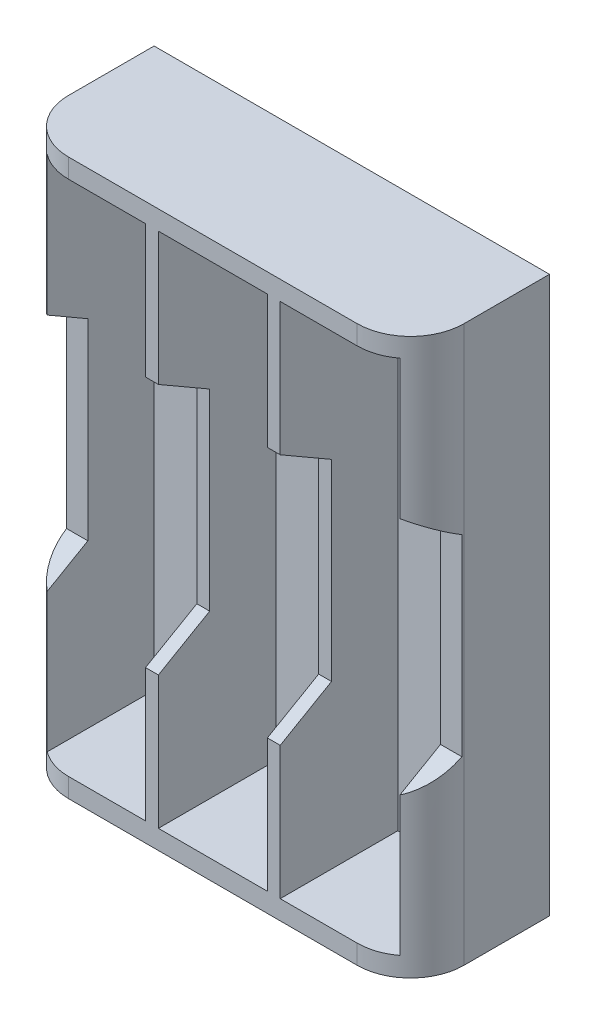
from build123d import *

# Parameters (mm, degrees)
SKETCH1_W               = 37
SKETCH1_H               = 52
BOSS_EXTRUDE1_DEPTH     = 2
BOSS_EXTRUDE2_DEPTH     = 52
SKETCH3_W               = 10.2
SKETCH3_H               = 48.4
CUT_EXTRUDE1_DEPTH      = 11
CUT_EXTRUDE2_DEPTH      = 35.456494308
CUT_EXTRUDE2_DEPTH_BACK = 35.456494308


with BuildPart() as part:
    # Sketch1 → Boss-Extrude1 (new body)
    with BuildSketch(Plane.XY):
        Rectangle(SKETCH1_W, SKETCH1_H)
    extrude(amount=BOSS_EXTRUDE1_DEPTH)

    # Sketch2 → Boss-Extrude2 (add)
    with BuildSketch(Plane.XZ.offset(26)):
        with BuildLine():
            Line((-13.5, 13), (13.5, 13))
            ThreePointArc((13.5, 13), (17.035533906, 11.535533906), (18.5, 8))
            Line((18.5, 8), (18.5, 2))
            Line((18.5, 2), (-18.5, 2))
            Line((-18.5, 2), (-18.5, 8))
            ThreePointArc((-18.5, 8), (-17.035533906, 11.535533906), (-13.5, 13))
        make_face()
    extrude(amount=-BOSS_EXTRUDE2_DEPTH)

    # Sketch3 → Cut-Extrude1 (cut)
    with BuildSketch(Plane.XY.offset(13)):
        Rectangle(SKETCH3_W, SKETCH3_H)
        with Locations((11.4, 0)):
            Rectangle(SKETCH3_W, SKETCH3_H)
        with Locations((-11.4, 0)):
            Rectangle(SKETCH3_W, SKETCH3_H)
    extrude(amount=-CUT_EXTRUDE1_DEPTH, mode=Mode.SUBTRACT)

    # Sketch4 → Cut-Extrude2 (cut, two sides: drawn at the far end of the back side and taken through both)
    with BuildSketch(Plane(origin=(0, 0, 0), x_dir=(0, 0, -1), z_dir=(1, 0, 0)).offset(-CUT_EXTRUDE2_DEPTH_BACK)):
        Polygon((-18, -14.658032638), (-18, 14.658032638), (-8.2, 9), (-8.2, -9), align=None)
    extrude(amount=CUT_EXTRUDE2_DEPTH + CUT_EXTRUDE2_DEPTH_BACK, mode=Mode.SUBTRACT)


solid = part.part
